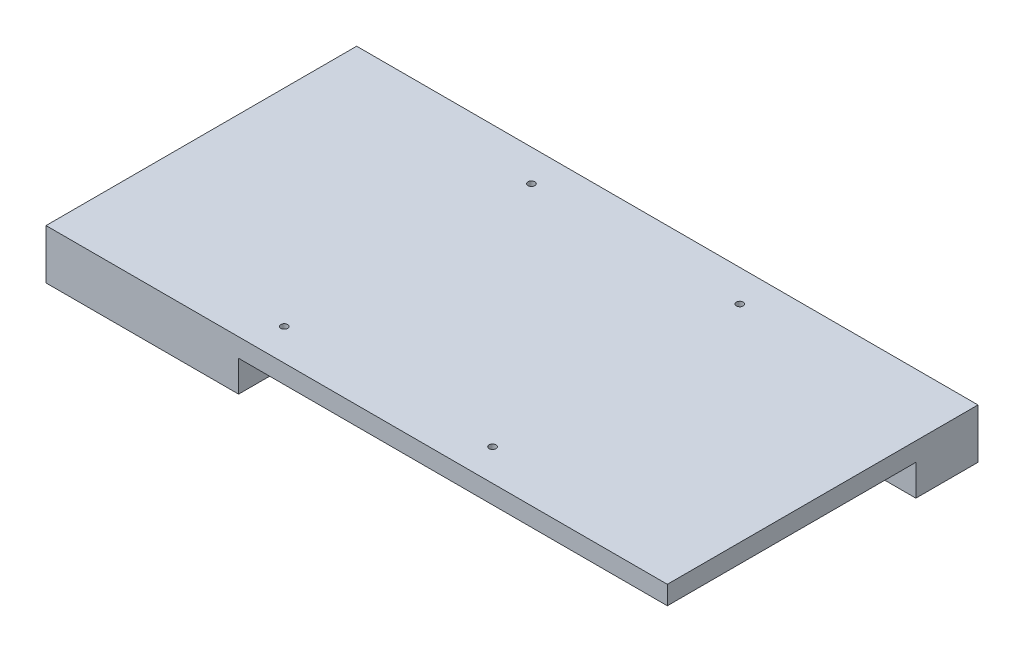
from build123d import *

# Parameters (mm, degrees)
SKETCH2_W           = 200
SKETCH2_H           = 100
BOSS_EXTRUDE1_DEPTH = 6
SKETCH3_R           = 1.1
CUT_EXTRUDE1_DEPTH  = 6
SKETCH4_W           = 62
SKETCH4_H           = 20
BOSS_EXTRUDE2_DEPTH = 10


with BuildPart() as part:
    # Sketch2 → Boss-Extrude1 (new body)
    with BuildSketch(Plane(origin=(0, 0, 0), x_dir=(1, 0, 0), z_dir=(0, 1, 0))):
        with Locations((100, -50)):
            Rectangle(SKETCH2_W, SKETCH2_H)
    extrude(amount=BOSS_EXTRUDE1_DEPTH)

    # Sketch3 → Cut-Extrude1 (cut)
    with BuildSketch(Plane(origin=(0, 6, 0), x_dir=(1, 0, 0), z_dir=(0, 1, 0))):
        with Locations(Location((66.465, -10.21, 0), (0, 0, 270))):
            Circle(SKETCH3_R)
        with Locations(Location((133.535, -10.21, 0), (0, 0, 270))):
            Circle(SKETCH3_R)
    cut_extrude1 = extrude(amount=-CUT_EXTRUDE1_DEPTH, mode=Mode.SUBTRACT)

    # Mirror1: Cut-Extrude1 across plane
    add(cut_extrude1.mirror(Plane.XY.offset(50)), mode=Mode.SUBTRACT)

    # Sketch4 → Boss-Extrude2 (add)
    with BuildSketch(Plane.XZ):
        with Locations((31, 90)):
            Rectangle(SKETCH4_W, SKETCH4_H)
        with Locations((169, 10)):
            Rectangle(SKETCH4_W, SKETCH4_H)
    extrude(amount=BOSS_EXTRUDE2_DEPTH)


solid = part.part
